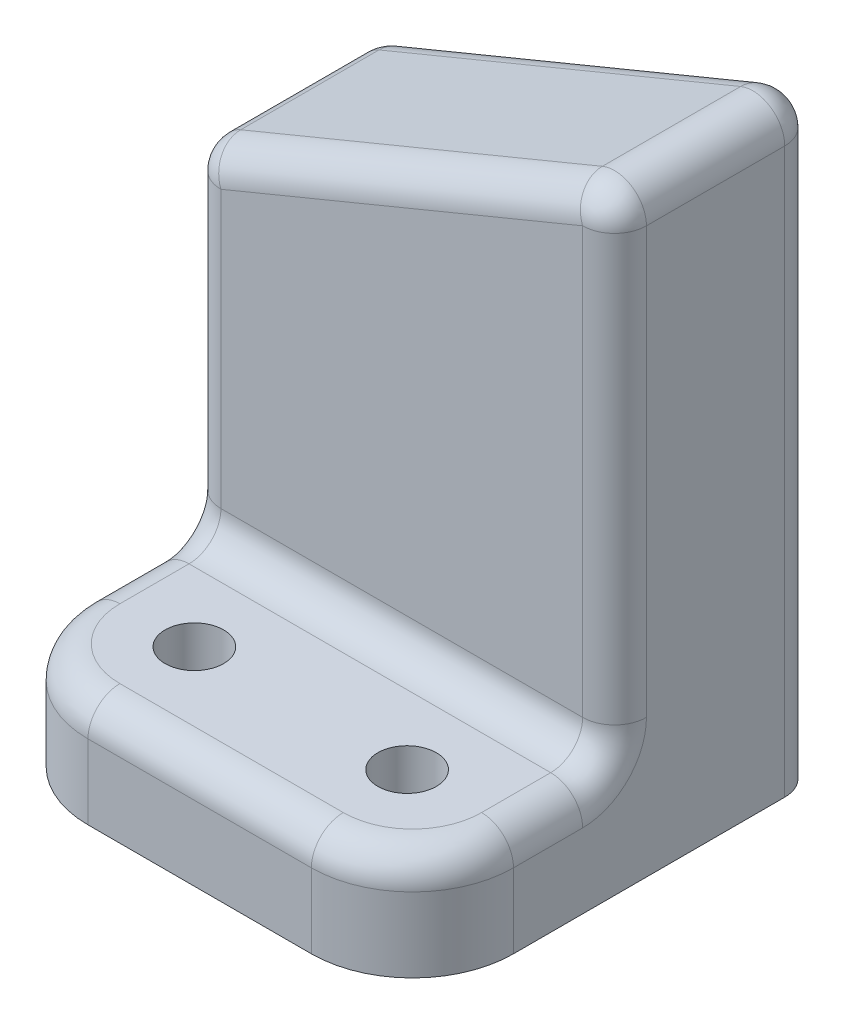
from build123d import *

# Parameters (mm, degrees)
PROFILE_EXTRUDE_DEPTH = 20
TOP_ANGLE_CUT_REACH   = 75.783
BASE_FILLET_R         = 9.5
TOP_EDGES_FILLETS_R   = 3
CORNER_FILLETS_R      = 3
MOUNTING_HOLES_D      = 5.5


with BuildPart() as part:
    # Profile Sketch → Profile Extrude (new, symmetric)
    with BuildSketch(Plane(origin=(0, 0, 0), x_dir=(0, 0, -1), z_dir=(1, 0, 0))):
        Polygon((0, 0), (0, 60), (-19, 60), (-19, 10), (-38, 10), (-38, 0), align=None)
    extrude(amount=PROFILE_EXTRUDE_DEPTH, both=True)

    # Top Angle Cut Sketch → Top Angle Cut (cut, up to next)
    with BuildSketch(Plane(origin=(0, 0, 0), x_dir=(-1, 0, 0), z_dir=(0, 0, -1)), mode=Mode.PRIVATE) as top_angle_cut_sk1:
        Polygon((-25.513067114, 59.774140185), (36.478511396, 34.20261405), (36.478511396, 65.529246439), (-25.513067114, 65.529246439), align=None)
    top_angle_cut_tool1 = extrude(top_angle_cut_sk1.sketch, amount=-TOP_ANGLE_CUT_REACH, mode=Mode.PRIVATE) & part.part
    add(top_angle_cut_tool1.solids().sort_by_distance((-12.60761, 54.789304, 0))[0], mode=Mode.SUBTRACT)

    # Base Fillet
    base_fillet_edges = [part.edges().sort_by_distance(p)[0] for p in [
        (20, 5, 38),
        (-20, 5, 38),
    ]]
    fillet(base_fillet_edges, radius=BASE_FILLET_R)

    # Top Edges Fillets
    top_edges_fillets_edges = [part.edges().sort_by_distance(p)[0] for p in [
        (0, 10, 19),
        (20, 57.5, 9.5),
        (-20, 41, 9.5),
    ]]
    fillet(top_edges_fillets_edges, radius=TOP_EDGES_FILLETS_R)

    # Corner Fillets
    corner_fillets_edges = [part.edges().sort_by_distance(p)[0] for p in [
        (0, 10, 38),
        (17.217514421, 10, 35.217514421),
        (-17.217514421, 10, 35.217514421),
        (20, 10, 25.25),
        (20, 33.00864359, 19),
        (-1.143992769, 48.778102983, 19),
        (-20, 25.99614359, 19),
        (-19.493188551, 40.66082272, 19),
        (18.66853554, 55.510475731, 19),
        (-1.143992769, 48.778102983, 0),
        (-19.493188551, 40.66082272, 0),
        (18.66853554, 55.510475731, 0),
        (-20, 10, 25.25),
        (-20, 10.878679656, 19.878679656),
        (20, 10.878679656, 19.878679656),
        (-20, 19.49614359, 0),
        (20, 26.50864359, 0),
    ]]
    fillet(corner_fillets_edges, radius=CORNER_FILLETS_R)

    # Mounting Holes (through all)
    with Locations(Plane(origin=(-10, 10, 28.5), x_dir=(0, 0, 1), z_dir=(0, 1, 0))):
        with Locations((0, 0), (0, 20)):
            Hole(MOUNTING_HOLES_D / 2)


solid = part.part
